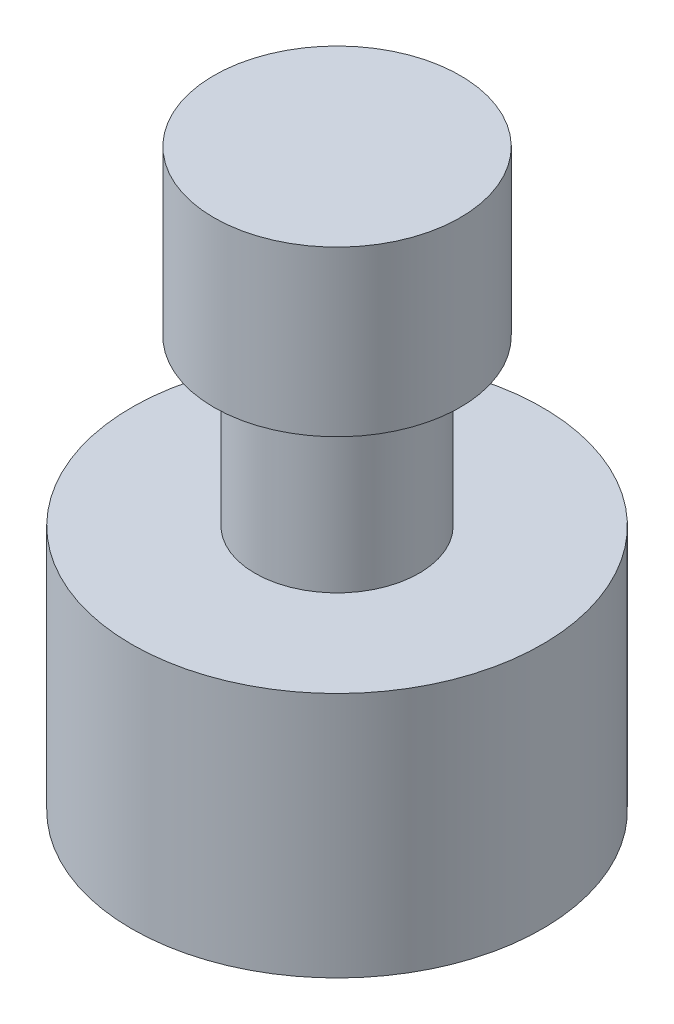
from build123d import *


with BuildPart() as part:
    # Sketch1 → Revolve2 (revolve)
    with BuildSketch(Plane.XY, mode=Mode.PRIVATE) as revolve2_sk:
        Polygon((0, 0), (25, 0), (25, 70), (10, 70), (10, 50), (15, 50), (15, 30), (0, 30), align=None)
    revolve(revolve2_sk.sketch.rotate(Axis((25, 70, 0), (0, -1, 0)), 270), axis=Axis((25, 70, 0), (0, -1, 0)))


solid = part.part
